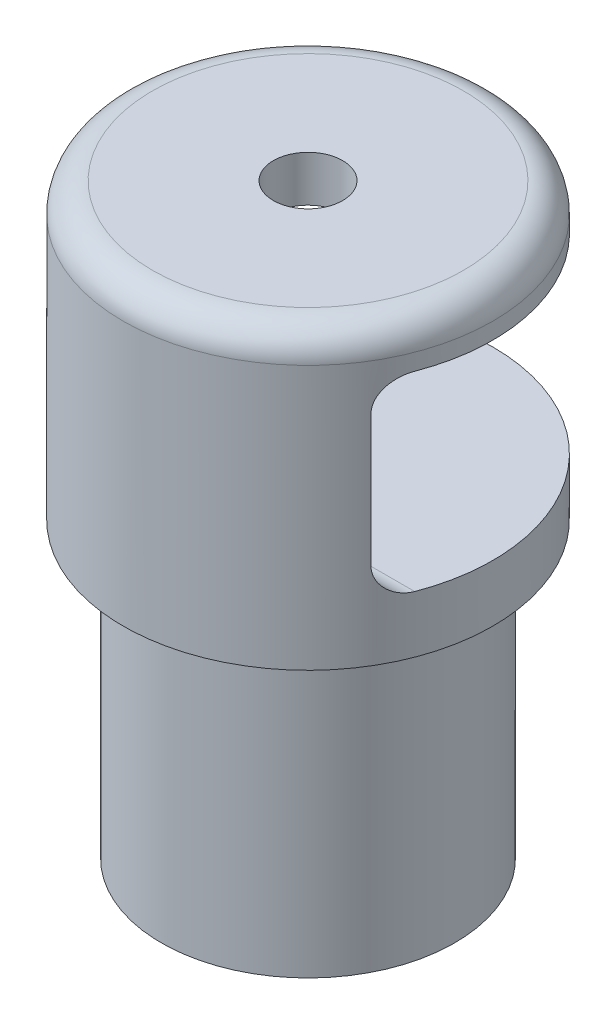
from build123d import *

# Parameters (mm, degrees)
SKETCH1_R               = 8.001
BOSS_EXTRUDE1_DEPTH     = 25.4
SKETCH2_R               = 8.001
SKETCH2_R_2             = 6.35
SKETCH2_R_3             = 4.699
CUT_EXTRUDE1_DEPTH      = 12.7
CUT_EXTRUDE4_DEPTH      = 4.1275
CUT_EXTRUDE4_DEPTH_BACK = 12.7
SKETCH5_W               = 21.214200292
SKETCH5_H               = 8.255
CUT_EXTRUDE5_REACH      = 29.806
SKETCH6_R               = 1.5
FILLET2_R               = 1.27
FILLET3_R               = 1.27
CUT_EXTRUDE6_REACH      = 20.919
SKETCH7_R               = 1.25


with BuildPart() as part:
    # Sketch1 → Boss-Extrude1 (new body)
    with BuildSketch(Plane(origin=(0, 0, 0), x_dir=(1, 0, 0), z_dir=(0, 1, 0))):
        with Locations(Location((0, 0, 0), (0, 0, 270))):
            Circle(SKETCH1_R)
    extrude(amount=BOSS_EXTRUDE1_DEPTH)

    # Sketch2 → Cut-Extrude1 (cut)
    # profile 1 of 2: a face of its own
    with BuildSketch(Plane(origin=(0, 0, 0), x_dir=(-1, 0, 0), z_dir=(0, -1, 0))):
        with Locations(Location((0, 0, 0), (0, 0, 90))):
            Circle(SKETCH2_R)
        with Locations(Location((0, 0, 0), (0, 0, 90))):
            Circle(SKETCH2_R_2, mode=Mode.SUBTRACT)
    # profile 2 of 2: a face of its own
    with BuildSketch(Plane(origin=(0, 0, 0), x_dir=(-1, 0, 0), z_dir=(0, -1, 0))):
        with Locations(Location((0, 0, 0), (0, 0, 90))):
            Circle(SKETCH2_R_3)
    extrude(amount=-CUT_EXTRUDE1_DEPTH, mode=Mode.SUBTRACT)

    # Sketch5 → Cut-Extrude4 (cut, two sides: drawn at the far end of the back side and taken through both)
    with BuildSketch(Plane.XY.offset(-CUT_EXTRUDE4_DEPTH_BACK)):
        with Locations((0.442410985, 19.289926646)):
            Rectangle(SKETCH5_W, SKETCH5_H)
    extrude(amount=CUT_EXTRUDE4_DEPTH + CUT_EXTRUDE4_DEPTH_BACK, mode=Mode.SUBTRACT)

    # Sketch6 → Cut-Extrude5 (cut, up to next)
    with BuildSketch(Plane(origin=(0, 25.4, 0), x_dir=(1, 0, 0), z_dir=(0, 1, 0)), mode=Mode.PRIVATE) as cut_extrude5_sk1:
        with Locations(Location((0, 0, 0), (0, 0, 270))):
            Circle(SKETCH6_R)
    cut_extrude5_tool1 = extrude(cut_extrude5_sk1.sketch, amount=-CUT_EXTRUDE5_REACH, mode=Mode.PRIVATE) & part.part
    add(cut_extrude5_tool1.solids().sort_by_distance((0, 25.4, 0))[0], mode=Mode.SUBTRACT)

    # Fillet2
    fillet2_edges = [part.edges().sort_by_distance(p)[0] for p in [
        (0, 23.417426646, 4.1275),
        (0, 15.162426646, 4.1275),
    ]]
    fillet(fillet2_edges, radius=FILLET2_R)

    # Fillet3
    fillet3_edges = [part.edges().sort_by_distance(p)[0] for p in [
        (0, 25.4, -8.001),
    ]]
    fillet(fillet3_edges, radius=FILLET3_R)

    # Sketch7 → Cut-Extrude6 (cut, up to next)
    with BuildSketch(Plane(origin=(0, 15.162426646, 0), x_dir=(1, 0, 0), z_dir=(0, 1, 0)), mode=Mode.PRIVATE) as cut_extrude6_sk1:
        with Locations(Location((0, 0, 0), (0, 0, 270))):
            Circle(SKETCH7_R)
    cut_extrude6_tool1 = extrude(cut_extrude6_sk1.sketch, amount=-CUT_EXTRUDE6_REACH, mode=Mode.PRIVATE) & part.part
    add(cut_extrude6_tool1.solids().sort_by_distance((0, 15.162427, 0))[0], mode=Mode.SUBTRACT)


solid = part.part
